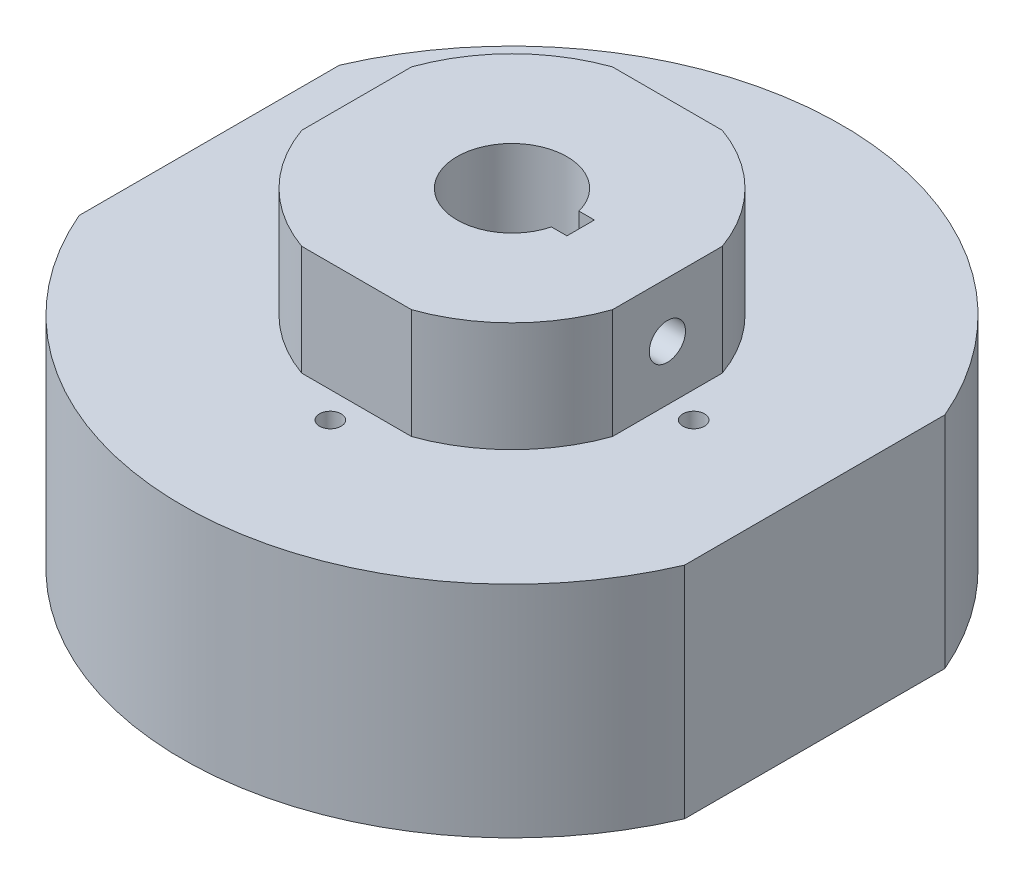
from build123d import *

# Parameters (mm, degrees)
SKETCH1_R           = 76.2
BOSS_EXTRUDE1_DEPTH = 76.2
SKETCH2_R           = 50
CUT_EXTRUDE1_DEPTH  = 36
SKETCH3_R           = 4
CUT_EXTRUDE3_DEPTH  = 25.4
CUT_EXTRUDE4_DEPTH  = 132.982271537
CUT_EXTRUDE5_START  = -25.4
SKETCH4_R           = 76.2
SKETCH4_R_2         = 38.1
SKETCH4_R_3         = 12.7
CUT_EXTRUDE5_DEPTH  = 25.4
SKETCH8_W           = 6.35
SKETCH8_H           = 6.35
CUT_EXTRUDE7_DEPTH  = 129.502451338
SKETCH10_R          = 12.7
CUT_EXTRUDE8_DEPTH  = 116.269597032
SKETCH9_R           = 2.0193
CUT_EXTRUDE9_DEPTH  = 138.794759062
CUT_EXTRUDE10_START = -25.4
SKETCH11_W          = 25.4
SKETCH11_H          = 2.178975516
SKETCH11_W_2        = 2.178975516
SKETCH11_H_2        = 25.4
CUT_EXTRUDE10_DEPTH = 25.4
SKETCH14_R          = 2.5
CUT_EXTRUDE13_DEPTH = 129.502451338
SKETCH15_R          = 4.191
CUT_EXTRUDE14_DEPTH = 12.7
CIRPATTERN1_COUNT   = 4


with BuildPart() as part:
    # Sketch1 → Boss-Extrude1 (new body)
    with BuildSketch(Plane(origin=(0, 0, 0), x_dir=(1, 0, 0), z_dir=(0, 1, 0))):
        Circle(SKETCH1_R)
    extrude(amount=BOSS_EXTRUDE1_DEPTH)

    # Sketch2 → Cut-Extrude1 (cut)
    with BuildSketch(Plane.XZ):
        Circle(SKETCH2_R)
    extrude(amount=-CUT_EXTRUDE1_DEPTH, mode=Mode.SUBTRACT)

    # Sketch3 → Cut-Extrude3 (cut)
    with BuildSketch(Plane.XZ):
        with Locations((0, 58)):
            Circle(SKETCH3_R)
        with Locations((50.229473419, 29)):
            Circle(SKETCH3_R)
        with Locations((50.229473419, -29)):
            Circle(SKETCH3_R)
        with Locations((0, -58)):
            Circle(SKETCH3_R)
        with Locations((-50.229473419, -29)):
            Circle(SKETCH3_R)
        with Locations((-50.229473419, 29)):
            Circle(SKETCH3_R)
    extrude(amount=-CUT_EXTRUDE3_DEPTH, mode=Mode.SUBTRACT)

    # Sketch5 → Cut-Extrude4 (cut, through all)
    with BuildSketch(Plane.XZ):
        Polygon((70, 0), (70, -30.10714201), (76.2, -30.10714201), (76.2, 30.10714201), (70, 30.10714201), align=None)
        Polygon((-70, 0), (-70, 30.10714201), (-76.35, 30.10714201), (-76.35, -30.10714201), (-70, -30.10714201), align=None)
    extrude(amount=-CUT_EXTRUDE4_DEPTH, mode=Mode.SUBTRACT)

    # Sketch4 → Cut-Extrude5 (cut)
    # profile 1 of 2: a face of its own
    with BuildSketch(Plane(origin=(0, 76.2, 0), x_dir=(1, 0, 0), z_dir=(0, 1, 0)).offset(CUT_EXTRUDE5_START)):
        Circle(SKETCH4_R)
        Circle(SKETCH4_R_2, mode=Mode.SUBTRACT)
    # profile 2 of 2: a face of its own
    with BuildSketch(Plane(origin=(0, 76.2, 0), x_dir=(1, 0, 0), z_dir=(0, 1, 0)).offset(CUT_EXTRUDE5_START)):
        Circle(SKETCH4_R_3)
    extrude(amount=CUT_EXTRUDE5_DEPTH, mode=Mode.SUBTRACT)

    # Sketch8 → Cut-Extrude7 (cut, through all)
    with BuildSketch(Plane(origin=(0, 76.2, 0), x_dir=(1, 0, 0), z_dir=(0, 1, 0))):
        with Locations((12.7, 0)):
            Rectangle(SKETCH8_W, SKETCH8_H)
    extrude(amount=-CUT_EXTRUDE7_DEPTH, mode=Mode.SUBTRACT)

    # Sketch10 → Cut-Extrude8 (cut, through all)
    with BuildSketch(Plane(origin=(0, 50.8, 0), x_dir=(1, 0, 0), z_dir=(0, 1, 0))):
        Circle(SKETCH10_R)
    extrude(amount=-CUT_EXTRUDE8_DEPTH, mode=Mode.SUBTRACT)

    # Sketch9 → Cut-Extrude9 (cut, through all)
    with BuildSketch(Plane.ZY.offset(-15.875)):
        with Locations((0, 63.5)):
            Circle(SKETCH9_R)
    extrude(amount=-CUT_EXTRUDE9_DEPTH, mode=Mode.SUBTRACT)

    # Sketch11 → Cut-Extrude10 (cut)
    with BuildSketch(Plane(origin=(0, 76.2, 0), x_dir=(1, 0, 0), z_dir=(0, 1, 0)).offset(CUT_EXTRUDE10_START)):
        with BuildLine():
            ThreePointArc((35.921024484, -12.7), (38.1, 0), (35.921024484, 12.7))
            Line((35.921024484, 12.7), (35.921024484, -12.7))
        make_face()
        with Locations((0, -37.010512242)):
            Rectangle(SKETCH11_W, SKETCH11_H)
        with Locations((0, 37.010512242)):
            Rectangle(SKETCH11_W, SKETCH11_H)
        with Locations((-37.010512242, 0)):
            Rectangle(SKETCH11_W_2, SKETCH11_H_2)
    extrude(amount=CUT_EXTRUDE10_DEPTH, mode=Mode.SUBTRACT)

    # Sketch14 → Cut-Extrude13 (cut, through all)
    with BuildSketch(Plane(origin=(0, 76.2, 0), x_dir=(1, 0, 0), z_dir=(0, 1, 0))):
        with Locations((-42, 0)):
            Circle(SKETCH14_R)
    cut_extrude13 = extrude(amount=-CUT_EXTRUDE13_DEPTH, mode=Mode.SUBTRACT)

    # Sketch15 → Cut-Extrude14 (cut)
    with BuildSketch(Plane(origin=(35.921024484, 0, 0), x_dir=(0, 0, -1), z_dir=(1, 0, 0))):
        with Locations((0, 63.5)):
            Circle(SKETCH15_R)
    extrude(amount=-CUT_EXTRUDE14_DEPTH, mode=Mode.SUBTRACT)

    # CirPattern1: Cut-Extrude13 ×4 about axis
    cirpattern1_axis = Axis((0, 76.2, 0), (0, 1, 0))
    for i in range(1, CIRPATTERN1_COUNT):
        add(cut_extrude13.rotate(cirpattern1_axis, i * 360 / CIRPATTERN1_COUNT), mode=Mode.SUBTRACT)


solid = part.part
